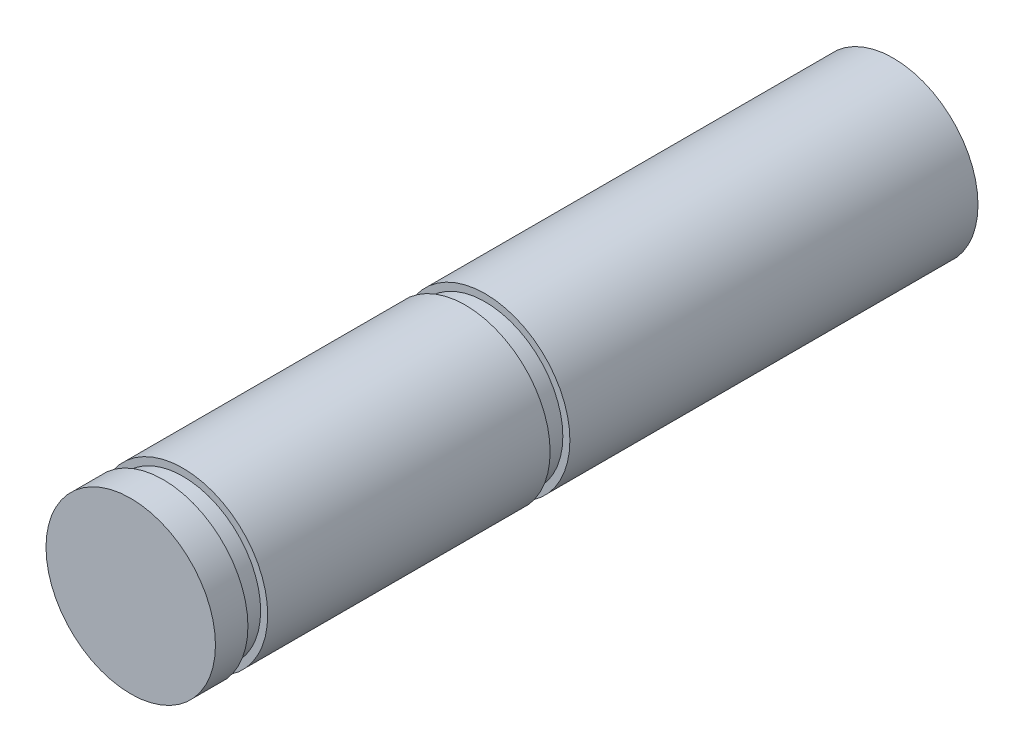
from build123d import *

# Parameters (mm, degrees)
SKETCH_1_R               = 3
EXTRUDE_1_DEPTH          = 27
CUT_EXTRUDE_1_DEPTH      = 0.35
CUT_EXTRUDE_1_DEPTH_BACK = 0.35
SKETCH_2_R               = 3
SKETCH_2_R_2             = 2.75
CUT_EXTRUDE_START        = -0.7
SKETCH_3_R               = 3
SKETCH_3_R_2             = 2.75
CUT_EXTRUDE_2_DEPTH      = 0.7


with BuildPart() as part:
    # 스케치1 → 보스-돌출1 (new body)
    with BuildSketch(Plane.XY):
        Circle(SKETCH_1_R)
    extrude(amount=EXTRUDE_1_DEPTH)

    # 스케치2 → 컷-돌출1 (cut, two sides: drawn at the far end of the back side and taken through both)
    with BuildSketch(Plane.XY.offset(25.5).offset(-CUT_EXTRUDE_1_DEPTH_BACK)):
        Circle(SKETCH_2_R)
        Circle(SKETCH_2_R_2, mode=Mode.SUBTRACT)
    extrude(amount=CUT_EXTRUDE_1_DEPTH + CUT_EXTRUDE_1_DEPTH_BACK, mode=Mode.SUBTRACT)

    # 스케치3 → 컷-돌출2 (cut)
    with BuildSketch(Plane.XY.offset(15.15).offset(CUT_EXTRUDE_START)):
        Circle(SKETCH_3_R)
        Circle(SKETCH_3_R_2, mode=Mode.SUBTRACT)
    extrude(amount=CUT_EXTRUDE_2_DEPTH, mode=Mode.SUBTRACT)


solid = part.part
